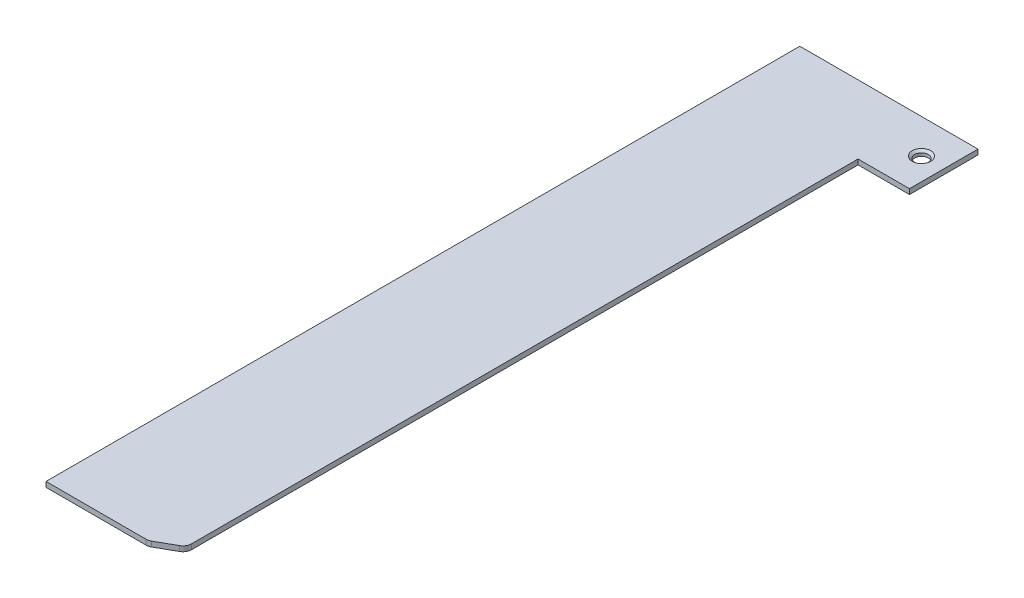
from build123d import *

# Parameters (mm, degrees)
BOSS_EXTRUDE2_DEPTH = 3
CUT_EXTRUDE1_DEPTH  = 10
FILLET1_R           = 5
FILLET2_R           = 5


with BuildPart() as part:
    # Sketch1 → Boss-Extrude2 (new body)
    with BuildSketch(Plane(origin=(0, 0, 0), x_dir=(1, 0, 0), z_dir=(0, 1, 0))):
        Polygon((37, 220), (67, 220), (67, 180), (37, 180), (37, -220), (-37, -220), (-37, 220), align=None)
    extrude(amount=BOSS_EXTRUDE2_DEPTH)

    # Sketch3 → 3/8-16 Tapped Hole1 (revolve, cut)
    with BuildSketch(Plane(origin=(54, 3, -200), x_dir=(0, 0, 1), z_dir=(1, 0, 0))):
        Polygon((0, 0), (0, 3), (3.96875, 3), (3.96875, 1.198863598), (5.3975, 0), align=None)
    revolve(axis=Axis((54, 9.35, -200), (0, -1, 0)), mode=Mode.SUBTRACT)

    # Sketch5 → Cut-Extrude1 (cut)
    with BuildSketch(Plane.XZ):
        Polygon((37, 220), (37, 211.960805492), (22.794358884, 220), align=None)
    extrude(amount=-CUT_EXTRUDE1_DEPTH, mode=Mode.SUBTRACT)

    # Fillet1
    fillet1_edges = [part.edges().sort_by_distance(p)[0] for p in [
        (37, 1.5, 211.960805492),
    ]]
    fillet(fillet1_edges, radius=FILLET1_R)

    # Fillet2
    fillet2_edges = [part.edges().sort_by_distance(p)[0] for p in [
        (22.794358884, 1.5, 220),
    ]]
    fillet(fillet2_edges, radius=FILLET2_R)


solid = part.part
